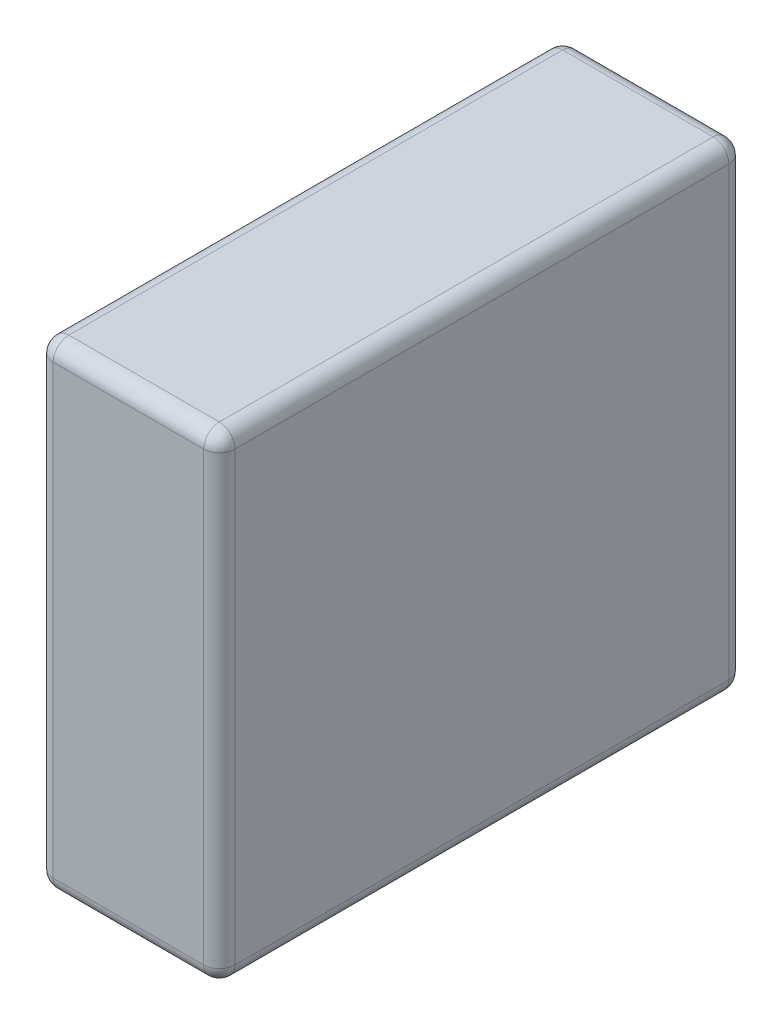
from build123d import *

# Parameters (mm, degrees)
EXTRUDE_1_DEPTH      = 30.5
EXTRUDE_1_DEPTH_BACK = 30.5
SKETCH_1_W           = 23.2
SKETCH_1_H           = 67
FILLET_2_R           = 2


with BuildPart() as part:
    # Эскиз1 → Бобышка-Вытянуть1 (new, two sides: drawn at the far end of the back side and taken through both)
    with BuildSketch(Plane(origin=(0, 0, 0), x_dir=(1, 0, 0), z_dir=(0, 1, 0)).offset(-EXTRUDE_1_DEPTH_BACK)):
        Rectangle(SKETCH_1_W, SKETCH_1_H)
    extrude(amount=EXTRUDE_1_DEPTH + EXTRUDE_1_DEPTH_BACK)

    # Скругление2
    fillet_2_edges = [part.edges().sort_by_distance(p)[0] for p in [
        (0, -30.5, -33.5),
        (0, 30.5, -33.5),
        (-11.6, -30.5, 0),
        (-11.6, 0, -33.5),
        (-11.6, 30.5, 0),
        (11.6, -30.5, 0),
        (11.6, 30.5, 0),
        (11.6, 0, -33.5),
        (0, -30.5, 33.5),
        (-11.6, 0, 33.5),
        (0, 30.5, 33.5),
        (11.6, 0, 33.5),
    ]]
    fillet(fillet_2_edges, radius=FILLET_2_R)


solid = part.part
